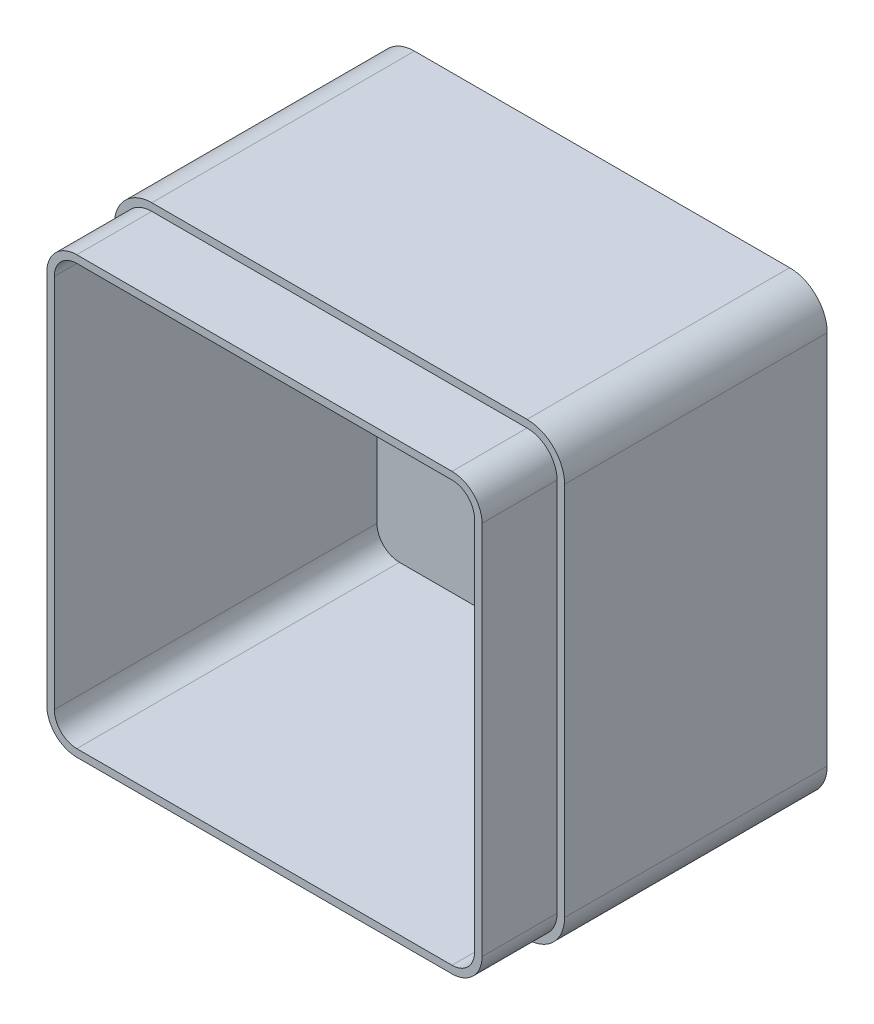
from build123d import *

# Parameters (mm, degrees)
SKETCH1_W           = 120
SKETCH1_H           = 120
BOSS_EXTRUDE1_DEPTH = 90
FILLET1_R           = 10
SHELL1_T            = -4
CUT_EXTRUDE4_DEPTH  = 20


with BuildPart() as part:
    # Sketch1 → Boss-Extrude1 (new body)
    with BuildSketch(Plane.XY):
        with Locations((60, 60)):
            Rectangle(SKETCH1_W, SKETCH1_H)
    extrude(amount=BOSS_EXTRUDE1_DEPTH)

    # Fillet1
    fillet1_edges = [part.edges().sort_by_distance(p)[0] for p in [
        (0, 120, 45),
        (120, 120, 45),
        (120, 0, 45),
        (0, 0, 45),
    ]]
    fillet(fillet1_edges, radius=FILLET1_R)

    # Shell1
    shell1_openings = [part.faces().sort_by_distance(p)[0] for p in [
        (60, 60, 90),
    ]]
    offset(amount=SHELL1_T, openings=shell1_openings, kind=Kind.INTERSECTION)

    # Sketch3 → Cut-Extrude4 (cut)
    with BuildSketch(Plane.XY.offset(90)):
        with BuildLine():
            Line((10, 0), (110, 0))
            ThreePointArc((110, 0), (117.071067812, 2.928932188), (120, 10))
            Line((120, 10), (120, 110))
            ThreePointArc((120, 110), (117.071067812, 117.071067812), (110, 120))
            Line((110, 120), (10, 120))
            ThreePointArc((10, 120), (2.928932188, 117.071067812), (0, 110))
            Line((0, 110), (0, 10))
            ThreePointArc((0, 10), (2.928932188, 2.928932188), (10, 0))
        make_face()
        with BuildLine():
            Line((10, 2), (110, 2))
            ThreePointArc((110, 2), (115.656854249, 4.343145751), (118, 10))
            Line((118, 10), (118, 110))
            ThreePointArc((118, 110), (115.656854249, 115.656854249), (110, 118))
            Line((110, 118), (10, 118))
            ThreePointArc((10, 118), (4.343145751, 115.656854249), (2, 110))
            Line((2, 110), (2, 10))
            ThreePointArc((2, 10), (4.343145751, 4.343145751), (10, 2))
        make_face(mode=Mode.SUBTRACT)
    extrude(amount=-CUT_EXTRUDE4_DEPTH, mode=Mode.SUBTRACT)


solid = part.part
